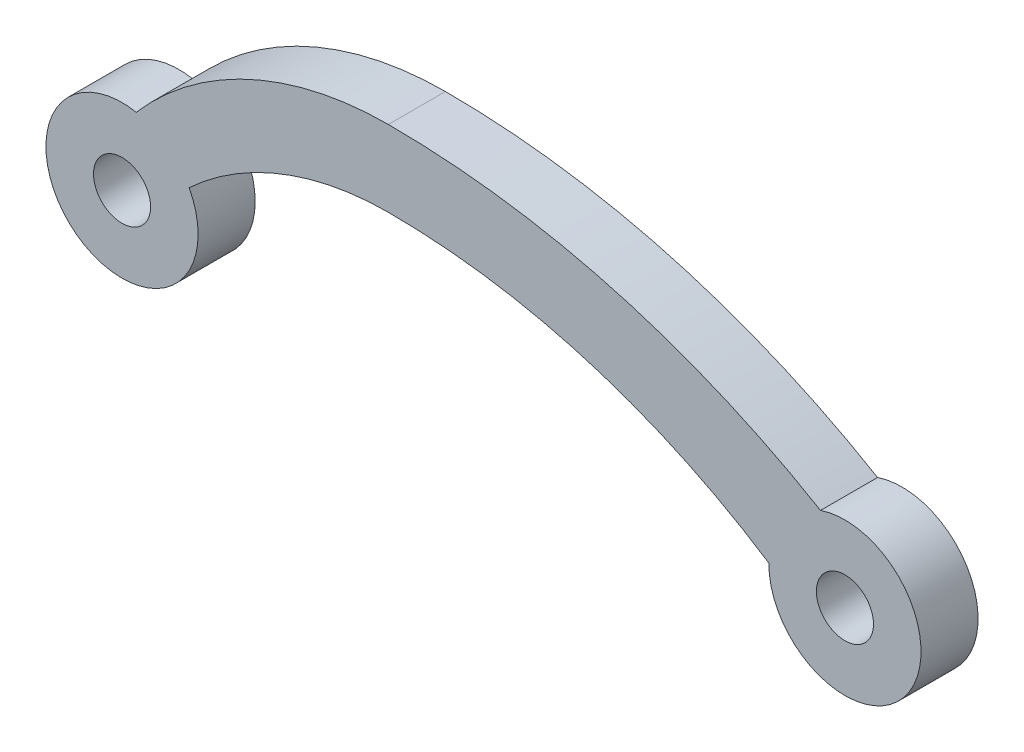
from build123d import *

# Parameters (mm, degrees)
CROQUIS1_R              = 1.5
SALIENTE_EXTRUIR1_DEPTH = 3


with BuildPart() as part:
    # Croquis1 → Saliente-Extruir1 (new body)
    with BuildSketch(Plane.XY):
        with BuildLine():
            ThreePointArc((14, 6), (24.435686691, 4.476369784), (34.000133515, 0.032681824))
            ThreePointArc((34.000133515, 0.032681824), (41.241241669, -2.344003507), (36.716180593, 3.788377981))
            ThreePointArc((36.716180593, 3.788377981), (25.775070157, 8.419103062), (14, 10))
            ThreePointArc((14, 10), (6.711840205, 8.410145405), (0.74792205, 3.929454492))
            ThreePointArc((0.74792205, 3.929454492), (-2.369034826, -3.222991466), (3.52713505, 1.886615578))
            ThreePointArc((3.52713505, 1.886615578), (8.37414825, 4.934787082), (14, 6))
        make_face()
        Circle(CROQUIS1_R, mode=Mode.SUBTRACT)
        with Locations((38, 0)):
            Circle(CROQUIS1_R, mode=Mode.SUBTRACT)
    extrude(amount=SALIENTE_EXTRUIR1_DEPTH)


solid = part.part
